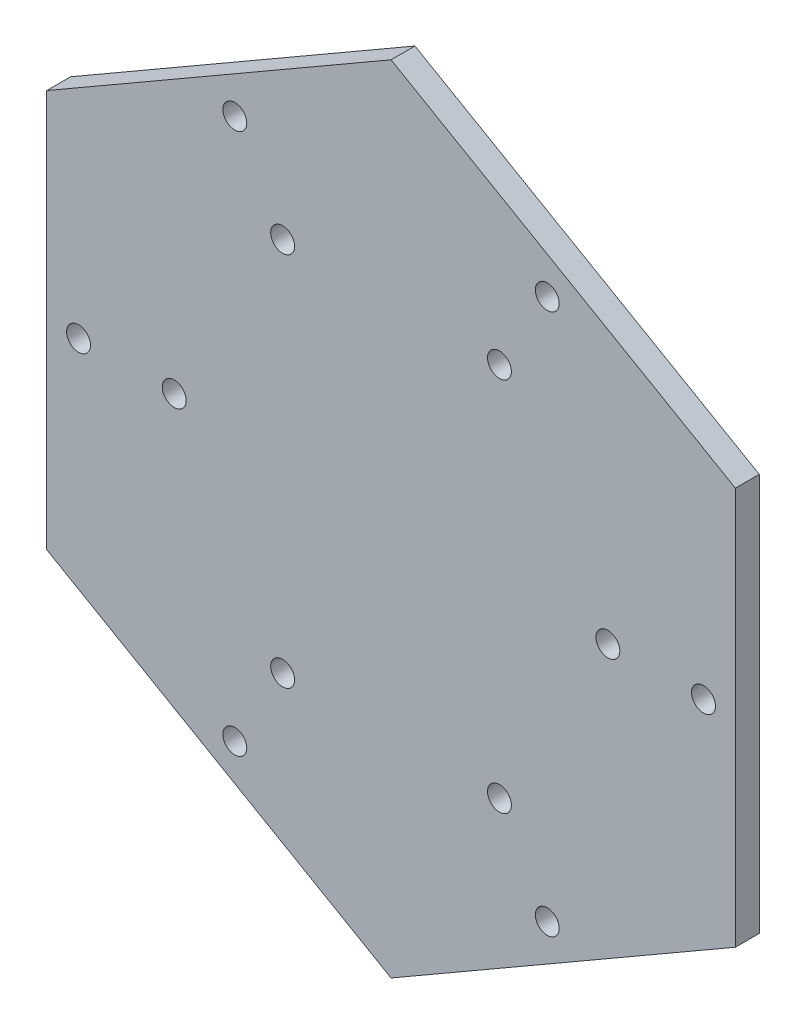
from build123d import *

# Parameters (mm, degrees)
BOSS_EXTRUDE1_DEPTH = 3
SKETCH2_R           = 1.5
CUT_EXTRUDE1_DEPTH  = 3


with BuildPart() as part:
    # Sketch1 → Boss-Extrude1 (new body)
    with BuildSketch(Plane.XY):
        Polygon((0, -49.890745052), (43.206652629, -24.945372526), (43.206652629, 24.945372526), (0, 49.890745052), (-43.206652629, 24.945372526), (-43.206652629, -24.945372526), align=None)
    extrude(amount=BOSS_EXTRUDE1_DEPTH)

    # Sketch2 → Cut-Extrude1 (cut)
    with BuildSketch(Plane.XY.offset(3)):
        with Locations((27.206652629, 0)):
            Circle(SKETCH2_R)
        with Locations((39.206652629, 0)):
            Circle(SKETCH2_R)
        with Locations((13.603326315, -23.561652329)):
            Circle(SKETCH2_R)
        with Locations((19.603326315, -33.953957174)):
            Circle(SKETCH2_R)
        with Locations((-13.603326315, -23.561652329)):
            Circle(SKETCH2_R)
        with Locations((-19.603326315, -33.953957174)):
            Circle(SKETCH2_R)
        with Locations((-27.206652629, 0)):
            Circle(SKETCH2_R)
        with Locations((-39.206652629, 0)):
            Circle(SKETCH2_R)
        with Locations((-13.603326315, 23.561652329)):
            Circle(SKETCH2_R)
        with Locations((-19.603326315, 33.953957174)):
            Circle(SKETCH2_R)
        with Locations((13.603326315, 23.561652329)):
            Circle(SKETCH2_R)
        with Locations((19.603326315, 33.953957174)):
            Circle(SKETCH2_R)
    extrude(amount=-CUT_EXTRUDE1_DEPTH, mode=Mode.SUBTRACT)


solid = part.part
